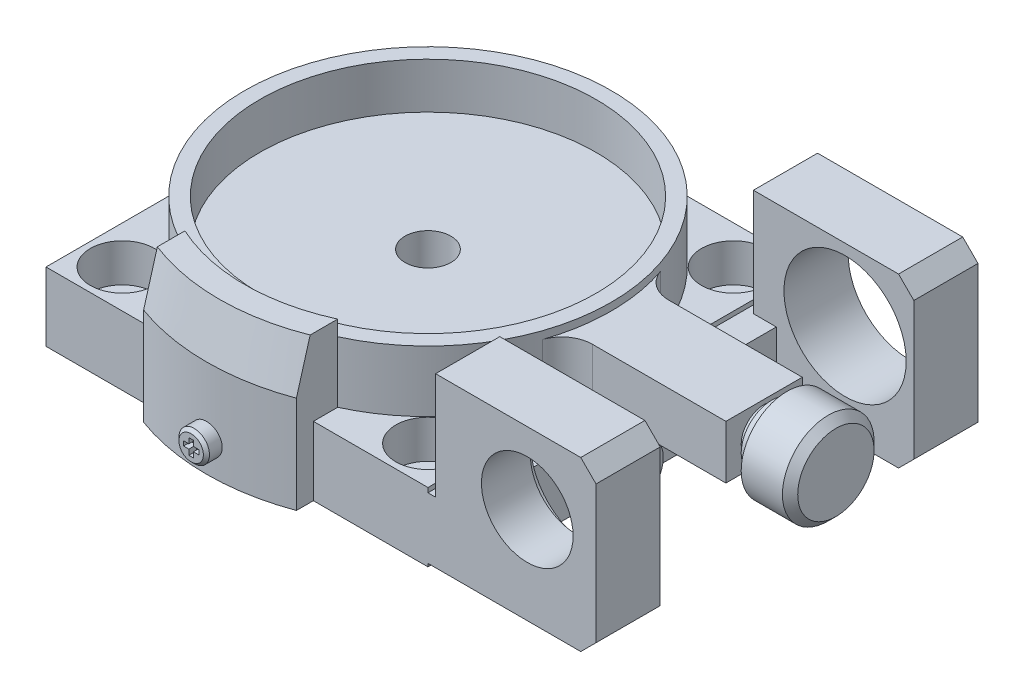
from build123d import *

# Parameters (mm, degrees)
EXTRUDE_1_DEPTH               = 12.5
EXTRUDE_1_DEPTH_BACK          = 12.5
SKETCH_1_W                    = 25
SKETCH_1_H                    = 4.5
CUT_EXTRUDE_1_DEPTH           = 0.2
CUT_EXTRUDE_1_DEPTH_BACK      = 0.2
PATTERN_LINEAR_1_COUNT        = 2
PATTERN_LINEAR_1_PITCH        = 20
PATTERN_LINEAR_1_COUNT_DIR2   = 2
PATTERN_LINEAR_1_PITCH_DIR2   = 20
EXTRUDE_2_DEPTH               = 3.5
SKETCH_8_W                    = 25
SKETCH_8_H                    = 4
EXTRUDE_3_DEPTH               = 2
EXTRUDE_4_DEPTH               = 4.2
SKETCH_10_R                   = 3
CUT_EXTRUDE_2_DEPTH           = 4.2
EXTRUDE_5_DEPTH               = 4.2
SKETCH_12_R                   = 4
CUT_EXTRUDE_3_DEPTH           = 4.2
SKETCH_13_W                   = 2
SKETCH_13_H                   = 1.9
CUT_EXTRUDE_4_DEPTH           = 1
SKETCH_15_R                   = 4
CUT_EXTRUDE_5_DEPTH           = 1
SKETCH_16_W                   = 2
SKETCH_16_H                   = 1.9
CUT_EXTRUDE_6_DEPTH           = 1
EXTRUDE_START                 = 9.5
EXTRUDE_6_DEPTH               = 9.5
CUT_REVOLVE_2_ANGLE           = 50
CUT_REVOLVE_2_OTHER_WAY_ANGLE = 50
CUT_EXTRUDE_7_DEPTH           = 0.5
SKETCH_22_R                   = 1.5
CUT_EXTRUDE_8_DEPTH           = 8.5


with BuildPart() as part:
    # 草图1 → 凸台-拉伸1 (new, two sides: drawn at the far end of the back side and taken through both)
    with BuildSketch(Plane.XY.offset(-EXTRUDE_1_DEPTH_BACK)):
        with Locations((0, 2.25)):
            Rectangle(SKETCH_1_W, SKETCH_1_H)
    extrude(amount=EXTRUDE_1_DEPTH + EXTRUDE_1_DEPTH_BACK)

    # 草图2 → 旋转1 (revolve)
    with BuildSketch(Plane(origin=(0, 0, 0), x_dir=(0, 0, -1), z_dir=(1, 0, 0))):
        Polygon((0, 4.5), (-12, 4.5), (-12, 8.5), (-11, 8.5), (-11, 5.5), (0, 5.5), align=None)
    revolve(axis=Axis((0, 5.5, 0), (0, -1, 0)))

    # 草图3 → 切除-拉伸1 (cut, two sides: drawn at the far end of the back side and taken through both)
    with BuildSketch(Plane(origin=(0, 0, 0), x_dir=(1, 0, 0), z_dir=(0, 1, 0)).offset(-CUT_EXTRUDE_1_DEPTH_BACK)):
        Polygon((-12.5, 4.5), (-12.5, -4.5), (-4.5, -4.5), (-4.5, -12.5), (4.5, -12.5), (4.5, -4.5), (12.5, -4.5), (12.5, 4.5), (4.5, 4.5), (4.5, 12.5), (-4.5, 12.5), (-4.5, 4.5), align=None)
    extrude(amount=CUT_EXTRUDE_1_DEPTH + CUT_EXTRUDE_1_DEPTH_BACK, mode=Mode.SUBTRACT)

    # 草图4 → 切除-旋转1 (revolve, cut)
    with BuildSketch(Plane(origin=(-10, 0, 0), x_dir=(0, 0, -1), z_dir=(1, 0, 0))):
        Polygon((10, 0), (8.75, 0), (8.75, 2), (7.9, 2), (7.9, 4.5), (10, 4.5), align=None)
    cut_revolve_1 = revolve(axis=Axis((-10, 4.5, -10), (0, -1, 0)), mode=Mode.SUBTRACT)

    # 阵列(线性)1: Cut-Revolve 1 2 × 2
    with Locations(*[(i * PATTERN_LINEAR_1_PITCH, 0, j * PATTERN_LINEAR_1_PITCH_DIR2) for i in range(PATTERN_LINEAR_1_COUNT) for j in range(PATTERN_LINEAR_1_COUNT_DIR2) if (i, j) != (0, 0)]):
        add(cut_revolve_1, mode=Mode.SUBTRACT)

    # 草图6 → 凸台-拉伸2 (add)
    with BuildSketch(Plane(origin=(0, 4.5, 0), x_dir=(1, 0, 0), z_dir=(0, 1, 0))):
        with BuildLine():
            Line((11.363205929, 3.857142857), (11.363205929, -3.857142857))
            ThreePointArc((11.363205929, -3.857142857), (12.092108839, -2.874313332), (13.257073584, -2.5))
            Line((13.257073584, -2.5), (22, -2.5))
            Line((22, -2.5), (22, 2.5))
            Line((22, 2.5), (13.257073584, 2.5))
            ThreePointArc((13.257073584, 2.5), (12.092108839, 2.874313332), (11.363205929, 3.857142857))
        make_face()
    extrude(amount=EXTRUDE_2_DEPTH)

    # 草图7 → 旋转2 (revolve)
    with BuildSketch(Plane.XY):
        Polygon((21.9, 6.2), (21.9, 7.7), (22.5, 7.7), (22.5, 8.2), (23.5, 8.2), (23.5, 9.2), (26.2, 9.2), (26.7, 8.7), (26.7, 6.2), align=None)
    revolve(axis=Axis((26.7, 6.2, 0), (-1, 0, 0)))

    # 草图8 → 凸台-拉伸3 (add)
    with BuildSketch(Plane(origin=(12.5, 0, 0), x_dir=(0, 0, -1), z_dir=(1, 0, 0))):
        with Locations((0, 2.2)):
            Rectangle(SKETCH_8_W, SKETCH_8_H)
    extrude(amount=EXTRUDE_3_DEPTH)

    # 草图9 → 凸台-拉伸4 (add)
    with BuildSketch(Plane.XY.offset(12.5)):
        Polygon((13, 0.2), (22.5, 0.2), (23.5, 1.2), (23.5, 10.2), (22.5, 11.2), (13, 11.2), align=None)
    extrude(amount=-EXTRUDE_4_DEPTH)

    # 草图10 → 切除-拉伸2 (cut)
    with BuildSketch(Plane.XY.offset(12.5)):
        with Locations((19, 6.5)):
            Circle(SKETCH_10_R)
    extrude(amount=-CUT_EXTRUDE_2_DEPTH, mode=Mode.SUBTRACT)

    # 草图11 → 凸台-拉伸5 (add)
    with BuildSketch(Plane.XY.offset(-12.5)):
        Polygon((13, 0.2), (22.5, 0.2), (23.5, 1.2), (23.5, 10.2), (22.5, 11.2), (13, 11.2), align=None)
    extrude(amount=EXTRUDE_5_DEPTH)

    # 草图12 → 切除-拉伸3 (cut)
    with BuildSketch(Plane.XY.offset(-12.5)):
        with Locations((19, 6.5)):
            Circle(SKETCH_12_R)
    extrude(amount=CUT_EXTRUDE_3_DEPTH, mode=Mode.SUBTRACT)

    # 草图13 → 旋转3 (revolve)
    with BuildSketch(Plane.XY.offset(-3)):
        with Locations((15.5, 3.45)):
            Rectangle(SKETCH_13_W, SKETCH_13_H)
    revolve(axis=Axis((16.5, 2.5, -3), (-1, 0, 0)))

    # 草图14 → 切除-拉伸4 (cut)
    with BuildSketch(Plane(origin=(16.5, 0, 0), x_dir=(0, 0, -1), z_dir=(1, 0, 0))):
        Polygon((2.566987298, 1.75), (3.433012702, 1.75), (3.866025404, 2.5), (3.433012702, 3.25), (2.566987298, 3.25), (2.133974596, 2.5), align=None)
    extrude(amount=-CUT_EXTRUDE_4_DEPTH, mode=Mode.SUBTRACT)

    # 草图15 → 切除-拉伸5 (cut)
    with BuildSketch(Plane.XY.offset(8.3)):
        with Locations((19, 6.2)):
            Circle(SKETCH_15_R)
    extrude(amount=CUT_EXTRUDE_5_DEPTH, mode=Mode.SUBTRACT)

    # 草图16 → 旋转4 (revolve)
    with BuildSketch(Plane.XY.offset(3)):
        with Locations((15.5, 3.45)):
            Rectangle(SKETCH_16_W, SKETCH_16_H)
    revolve(axis=Axis((16.5, 2.5, 3), (-1, 0, 0)))

    # 草图17 → 切除-拉伸6 (cut)
    with BuildSketch(Plane(origin=(16.5, 0, 0), x_dir=(0, 0, -1), z_dir=(1, 0, 0))):
        Polygon((-3.433012702, 1.75), (-2.566987298, 1.75), (-2.133974596, 2.5), (-2.566987298, 3.25), (-3.433012702, 3.25), (-3.866025404, 2.5), align=None)
    extrude(amount=-CUT_EXTRUDE_6_DEPTH, mode=Mode.SUBTRACT)

    # 草图18 → 凸台-拉伸6 (add)
    with BuildSketch(Plane(origin=(0, 0, 0), x_dir=(1, 0, 0), z_dir=(0, 1, 0)).offset(EXTRUDE_START)):
        with BuildLine():
            Line((5, -13.610657589), (5, -10.908712115))
            ThreePointArc((5, -10.908712115), (0, -12), (-5, -10.908712115))
            Line((-5, -10.908712115), (-5, -13.610657589))
            ThreePointArc((-5, -13.610657589), (0, -14.5), (5, -13.610657589))
        make_face()
    extrude(amount=-EXTRUDE_6_DEPTH)

    # 草图19 → 切除-旋转2 (revolve, cut)
    with BuildSketch(Plane(origin=(0, 0, 0), x_dir=(0, 0, -1), z_dir=(1, 0, 0))):
        Polygon((-16, 4.5), (-15, 4.5), (-13.606664199, 9.7), (-16, 9.7), align=None)
    revolve(axis=Axis((0, 9.7, 0), (0, 1, 0)), revolution_arc=CUT_REVOLVE_2_ANGLE, mode=Mode.SUBTRACT)

    # 草图19 → 切除-旋转2 other way (revolve, cut)
    with BuildSketch(Plane(origin=(0, 0, 0), x_dir=(0, 0, -1), z_dir=(1, 0, 0))):
        Polygon((-16, 4.5), (-15, 4.5), (-13.606664199, 9.7), (-16, 9.7), align=None)
    revolve(axis=Axis((0, 9.7, 0), (0, -1, 0)), revolution_arc=CUT_REVOLVE_2_OTHER_WAY_ANGLE, mode=Mode.SUBTRACT)

    # 草图20 → 旋转5 (revolve)
    with BuildSketch(Plane(origin=(0, 0, 0), x_dir=(0, 0, -1), z_dir=(1, 0, 0))):
        Polygon((-14, 2), (-14, 1), (-15.3, 1), (-15.5, 1.2), (-15.5, 2), align=None)
    revolve(axis=Axis((0, 2, 15.5), (0, 0, -1)))

    # 草图21 → 切除-拉伸7 (cut)
    with BuildSketch(Plane.XY.offset(15.5)):
        Polygon((0.15, 2.5), (-0.15, 2.5), (-0.15, 2.15), (-0.5, 2.15), (-0.5, 1.85), (-0.15, 1.85), (-0.15, 1.5), (0.15, 1.5), (0.15, 1.85), (0.5, 1.85), (0.5, 2.15), (0.15, 2.15), align=None)
    extrude(amount=-CUT_EXTRUDE_7_DEPTH, mode=Mode.SUBTRACT)

    # 草图22 → 切除-拉伸8 (cut)
    with BuildSketch(Plane(origin=(0, 0, 0), x_dir=(1, 0, 0), z_dir=(0, 1, 0))):
        Circle(SKETCH_22_R)
    extrude(amount=CUT_EXTRUDE_8_DEPTH, mode=Mode.SUBTRACT)


solid = part.part
